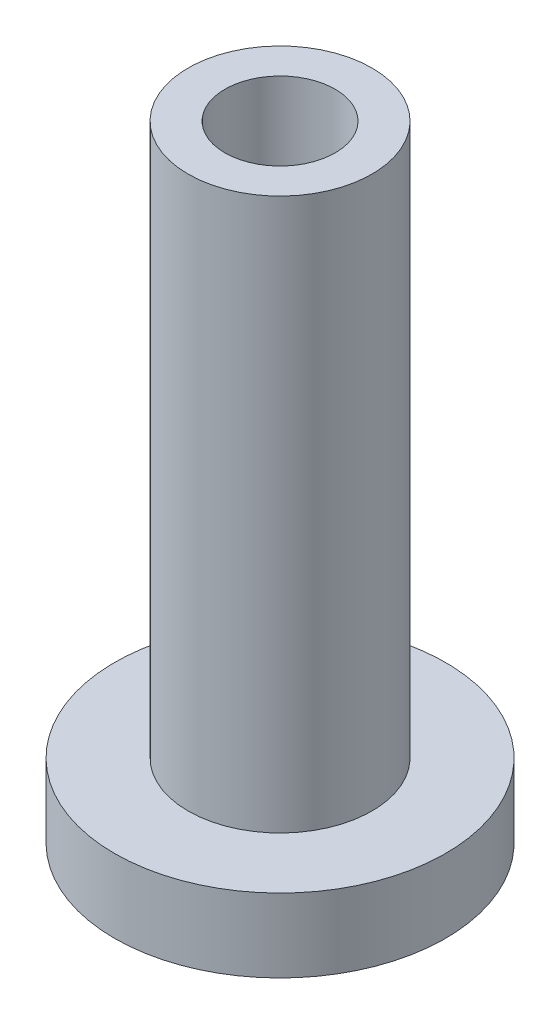
from build123d import *

# Parameters (mm, degrees)
SKETCH2_R           = 4.5
SKETCH2_R_2         = 2.5
BOSS_EXTRUDE1_DEPTH = 2
SKETCH2_3_R         = 2.5
BOSS_EXTRUDE2_DEPTH = 15
CUT_EXTRUDE1_START  = -15
SKETCH3_R           = 1.5
CUT_EXTRUDE1_DEPTH  = 34.152134861


with BuildPart() as part:
    # Sketch2 → Boss-Extrude1 (new body)
    # profile 1 of 2: a face of its own
    with BuildSketch(Plane(origin=(0, 0, 0), x_dir=(1, 0, 0), z_dir=(0, 1, 0))):
        with Locations(Location((0, 0, 0), (0, 0, 270))):
            Circle(SKETCH2_R)
        Circle(SKETCH2_R_2, mode=Mode.SUBTRACT)
    # profile 2 of 2: a face of its own
    with BuildSketch(Plane(origin=(0, 0, 0), x_dir=(1, 0, 0), z_dir=(0, 1, 0))):
        Circle(SKETCH2_R_2)
    extrude(amount=-BOSS_EXTRUDE1_DEPTH)

    # Sketch2<3> → Boss-Extrude2 (add)
    with BuildSketch(Plane(origin=(0, 0, 0), x_dir=(1, 0, 0), z_dir=(0, 1, 0))):
        with Locations(Location((0, 0, 0), (0, 0, 270))):
            Circle(SKETCH2_3_R)
    extrude(amount=BOSS_EXTRUDE2_DEPTH)

    # Sketch3 → Cut-Extrude1 (cut, through all)
    with BuildSketch(Plane(origin=(0, 15, 0), x_dir=(1, 0, 0), z_dir=(0, 1, 0)).offset(CUT_EXTRUDE1_START)):
        with Locations(Location((0, 0, 0), (0, 0, 270))):
            Circle(SKETCH3_R)
    extrude(amount=CUT_EXTRUDE1_DEPTH, mode=Mode.SUBTRACT)


solid = part.part
